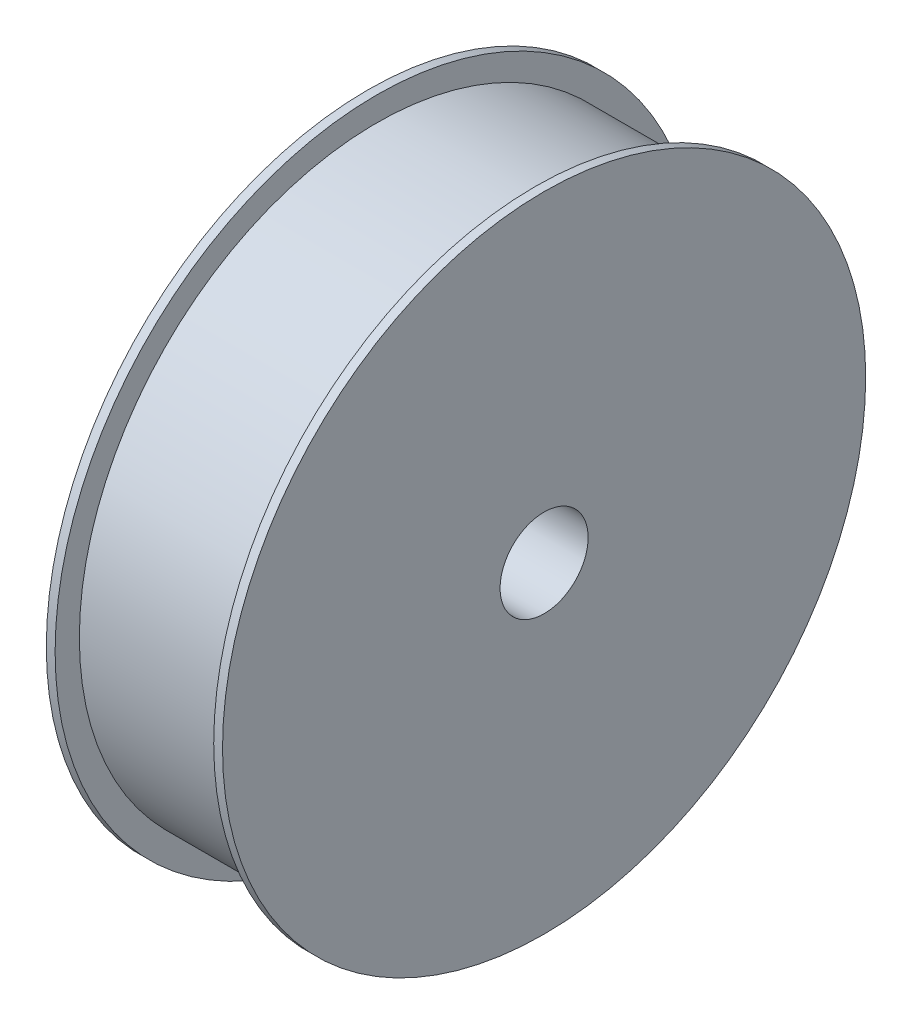
from build123d import *


with BuildPart() as part:
    # Sketch1 → Revolve1 (revolve)
    with BuildSketch(Plane.XY, mode=Mode.PRIVATE) as revolve1_sk:
        Polygon((64.930764312, 36.5), (63.930764312, 36.5), (63.930764312, 33.75), (45.930764312, 33.75), (45.930764312, 36.5), (44.930764312, 36.5), (44.930764312, 29.08167039), (44.930764312, 25), (37.930764312, 25), (37.930764312, 5), (44.930764312, 5), (64.930764312, 5), align=None)
    revolve(revolve1_sk.sketch.rotate(Axis((-58.16661515, 0, 0), (1, 0, 0)), 90), axis=Axis((-58.16661515, 0, 0), (1, 0, 0)))


solid = part.part
